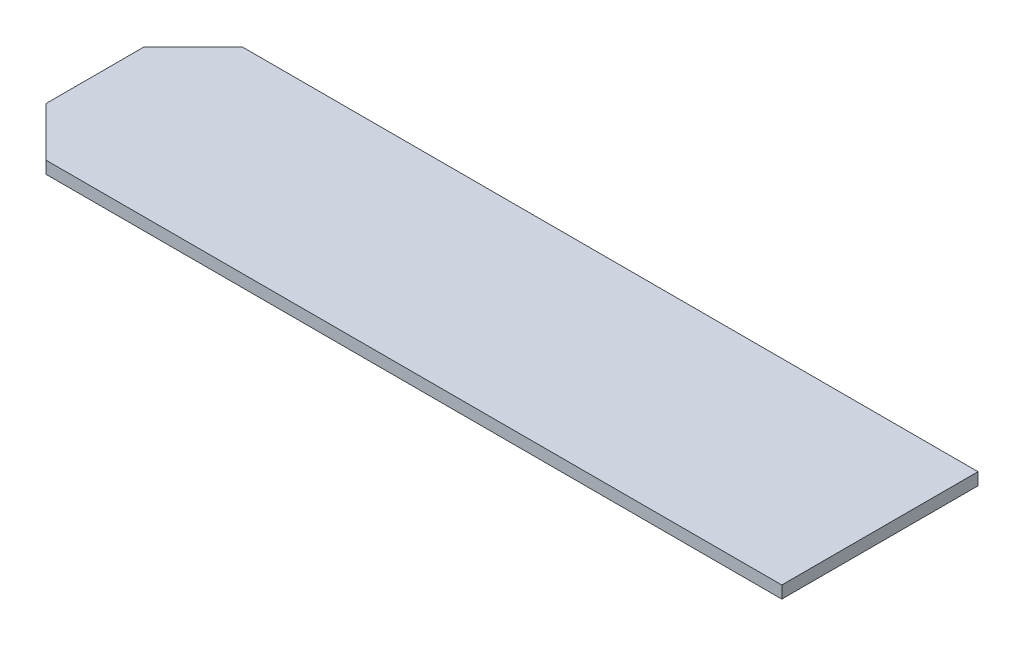
from build123d import *

# Parameters (mm, degrees)
SKETCH1_W           = 203.2
SKETCH1_H           = 50.8
BOSS_EXTRUDE1_DEPTH = 3.175
CHAMFER1_SIZE       = 12.7


with BuildPart() as part:
    # Sketch1 → Boss-Extrude1 (new body)
    with BuildSketch(Plane(origin=(0, 0, 0), x_dir=(1, 0, 0), z_dir=(0, 1, 0))):
        with Locations((-101.6, 25.4)):
            Rectangle(SKETCH1_W, SKETCH1_H)
    extrude(amount=BOSS_EXTRUDE1_DEPTH)

    # Chamfer1
    chamfer1_edges = [part.edges().sort_by_distance(p)[0] for p in [
        (-203.2, 1.5875, 0),
        (-203.2, 1.5875, -50.8),
    ]]
    chamfer(chamfer1_edges, length=CHAMFER1_SIZE)


solid = part.part
